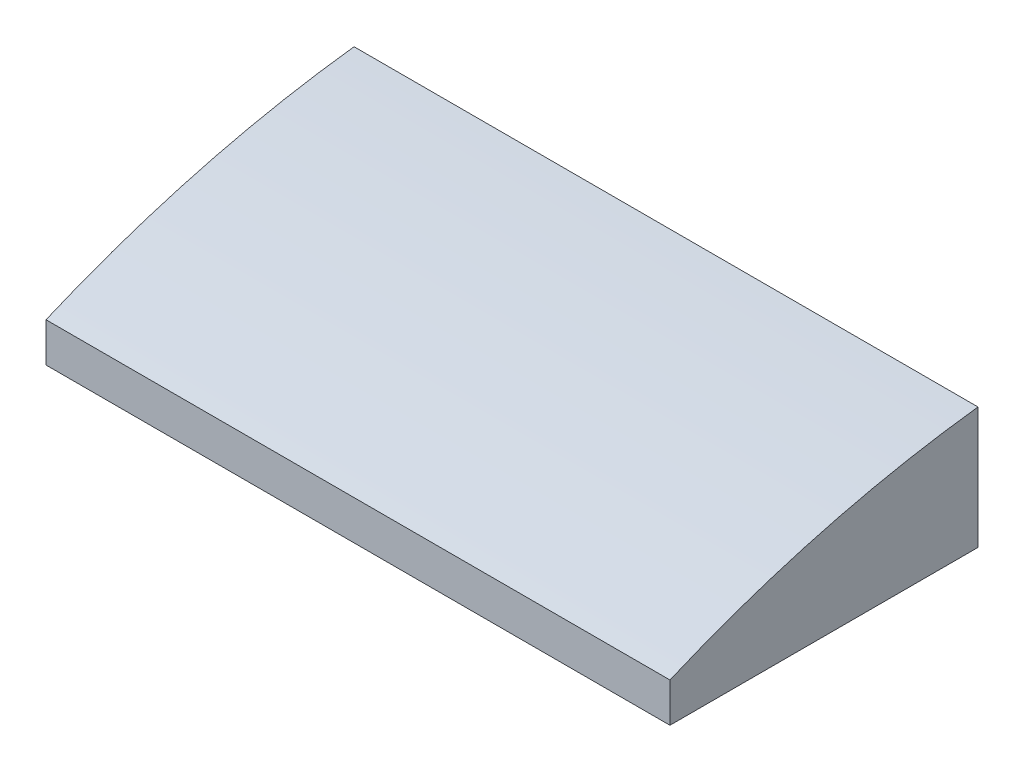
from build123d import *

# Parameters (mm, degrees)
BOSS_EXTRUDE1_DEPTH      = 31.8
CUT_EXTRUDE1_REACH       = 35.336
CUT_EXTRUDE1_END_RADIUS  = 57.3
SKETCH2_W                = 29.4
SKETCH2_H                = 13.3
BOSS_EXTRUDE2_REACH      = 35.336
BOSS_EXTRUDE2_END_RADIUS = 57.3
SKETCH3_R                = 3.25
SKETCH3_R_2              = 2.4
SKETCH4_R                = 3.25
SKETCH4_R_2              = 2.4
CUT_EXTRUDE2_DEPTH       = 0.2
LPATTERN1_COUNT          = 2
LPATTERN1_PITCH          = 8
LPATTERN2_COUNT          = 2
LPATTERN2_PITCH          = 8
SKETCH5_W                = 29.4
SKETCH5_H                = 2.5
CUT_EXTRUDE3_DEPTH       = 0.3


with BuildPart() as part:
    # Sketch1 → Boss-Extrude1 (new body)
    with BuildSketch(Plane(origin=(0, 0, 0), x_dir=(0, 0, -1), z_dir=(1, 0, 0))):
        with BuildLine():
            Line((-7.85, 0), (7.85, 0))
            Line((7.85, 0), (7.85, 6.2))
            ThreePointArc((7.85, 6.2), (-0.147838397, 4.652634009), (-7.85, 2))
            Line((-7.85, 2), (-7.85, 0))
        make_face()
    extrude(amount=-BOSS_EXTRUDE1_DEPTH)

    # Cut-Extrude1: up to this cylinder (the profile starts inside it)
    cut_extrude1_end = Plane(origin=(-15.9, -51.377128325, -14.841015221), z_dir=(1, 0, 0)) * Cylinder(CUT_EXTRUDE1_END_RADIUS, 186.272, mode=Mode.PRIVATE)
    # Sketch2 → Cut-Extrude1 (cut, up to the surface)
    with BuildSketch(Plane.XZ, mode=Mode.PRIVATE) as cut_extrude1_sk1:
        with Locations((-15.9, 0)):
            Rectangle(SKETCH2_W, SKETCH2_H)
    cut_extrude1_tool1 = extrude(cut_extrude1_sk1.sketch, amount=-CUT_EXTRUDE1_REACH, mode=Mode.PRIVATE) & cut_extrude1_end
    add(cut_extrude1_tool1.solids().sort_by_distance((-15.9, 0, 0))[0], mode=Mode.SUBTRACT)

    # Boss-Extrude2: up to this cylinder (the profile starts inside it)
    boss_extrude2_end = Plane(origin=(-15.9, -51.377128325, -14.841015221), z_dir=(1, 0, 0)) * Cylinder(BOSS_EXTRUDE2_END_RADIUS, 186.272, mode=Mode.PRIVATE)
    # Sketch3 → Boss-Extrude2 (add, up to the surface)
    with BuildSketch(Plane.XZ, mode=Mode.PRIVATE) as boss_extrude2_sk1:
        with Locations(Location((-15.9, 0, 0), (0, 0, 270))):
            Circle(SKETCH3_R)
        with Locations(Location((-15.9, 0, 0), (0, 0, 270))):
            Circle(SKETCH3_R_2, mode=Mode.SUBTRACT)
    boss_extrude2_tool1 = extrude(boss_extrude2_sk1.sketch, amount=-BOSS_EXTRUDE2_REACH, mode=Mode.PRIVATE) & boss_extrude2_end
    boss_extrude2 = boss_extrude2_tool1.solids().sort_by_distance((-15.9, 0, 3.158076))[0]
    add(boss_extrude2)

    # Sketch4 → Cut-Extrude2 (cut)
    with BuildSketch(Plane.XZ):
        with Locations(Location((-15.9, 0, 0), (0, 0, 270))):
            Circle(SKETCH4_R)
        with Locations(Location((-15.9, 0, 0), (0, 0, 270))):
            Circle(SKETCH4_R_2, mode=Mode.SUBTRACT)
    cut_extrude2 = extrude(amount=-CUT_EXTRUDE2_DEPTH, mode=Mode.SUBTRACT)

    # LPattern1: Boss-Extrude2, Cut-Extrude2 ×2
    with Locations(*[(i * LPATTERN1_PITCH, 0, 0) for i in range(1, LPATTERN1_COUNT)]):
        add(boss_extrude2)
        add(cut_extrude2, mode=Mode.SUBTRACT)

    # LPattern2: Boss-Extrude2, Cut-Extrude2 ×2
    with Locations(*[(-i * LPATTERN2_PITCH, 0, 0) for i in range(1, LPATTERN2_COUNT)]):
        add(boss_extrude2)
        add(cut_extrude2, mode=Mode.SUBTRACT)

    # Sketch5 → Cut-Extrude3 (cut)
    with BuildSketch(Plane(origin=(0, 2, 0), x_dir=(-1, 0, 0), z_dir=(0, -1, 0))):
        with Locations((15.9, -5.4)):
            Rectangle(SKETCH5_W, SKETCH5_H)
    extrude(amount=-CUT_EXTRUDE3_DEPTH, mode=Mode.SUBTRACT)


solid = part.part
